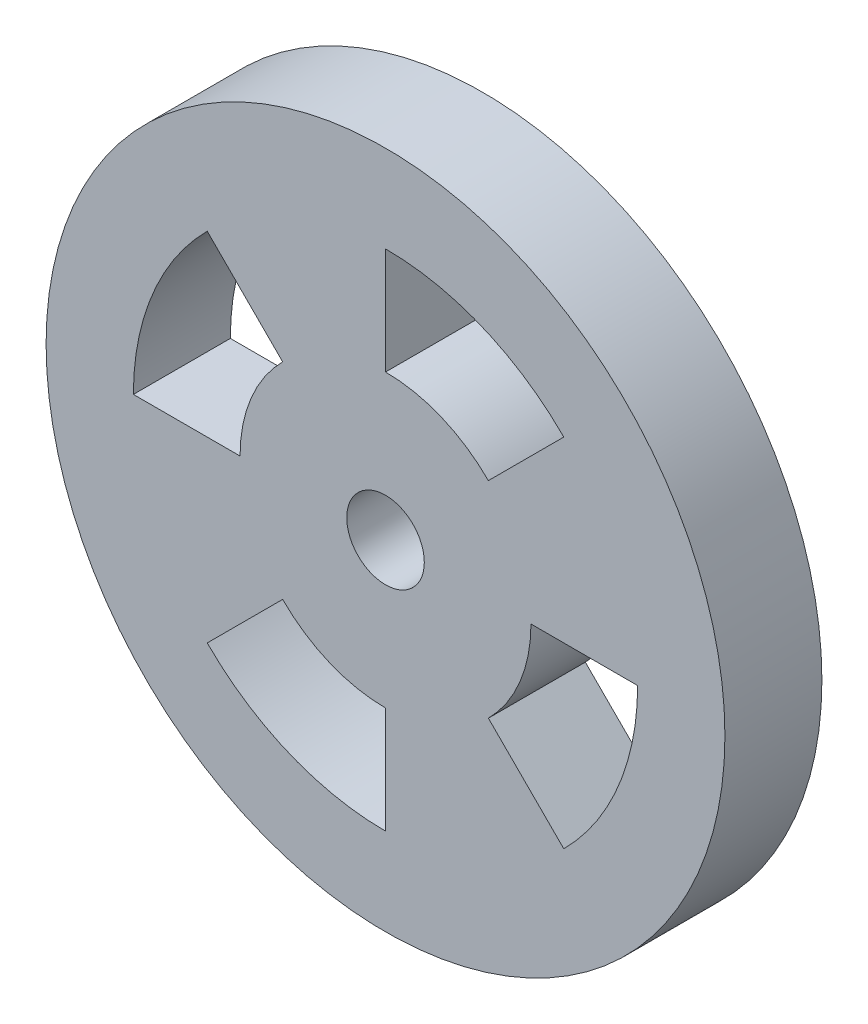
from build123d import *

# Parameters (mm, degrees)
SKETCH2_R           = 3.5
BOSS_EXTRUDE1_DEPTH = 1
SKETCH4_R           = 0.4
CUT_EXTRUDE2_DEPTH  = 6.049752469
CUT_EXTRUDE3_DEPTH  = 6.049752469
CIRPATTERN1_COUNT   = 4


with BuildPart() as part:
    # Sketch2 → Boss-Extrude1 (new body)
    with BuildSketch(Plane.XY):
        Circle(SKETCH2_R)
    extrude(amount=BOSS_EXTRUDE1_DEPTH)

    # Sketch4 → Cut-Extrude2 (cut, through all)
    with BuildSketch(Plane.XY.offset(1)):
        Circle(SKETCH4_R)
    extrude(amount=-CUT_EXTRUDE2_DEPTH, mode=Mode.SUBTRACT)

    # Sketch5 → Cut-Extrude3 (cut, through all)
    with BuildSketch(Plane.XY.offset(1)):
        with BuildLine():
            Line((-1.060660172, -1.060660172), (-1.838477631, -1.838477631))
            ThreePointArc((-1.838477631, -1.838477631), (-0.994976924, -2.402086785), (0, -2.6))
            Line((0, -2.6), (0, -1.5))
            ThreePointArc((0, -1.5), (-0.574025149, -1.385819299), (-1.060660172, -1.060660172))
        make_face()
    cut_extrude3 = extrude(amount=-CUT_EXTRUDE3_DEPTH, mode=Mode.SUBTRACT)

    # CirPattern1: Cut-Extrude3 ×4 about axis
    cirpattern1_axis = Axis((0, 0, 1), (0, 0, 1))
    for i in range(1, CIRPATTERN1_COUNT):
        add(cut_extrude3.rotate(cirpattern1_axis, i * 360 / CIRPATTERN1_COUNT), mode=Mode.SUBTRACT)


solid = part.part
